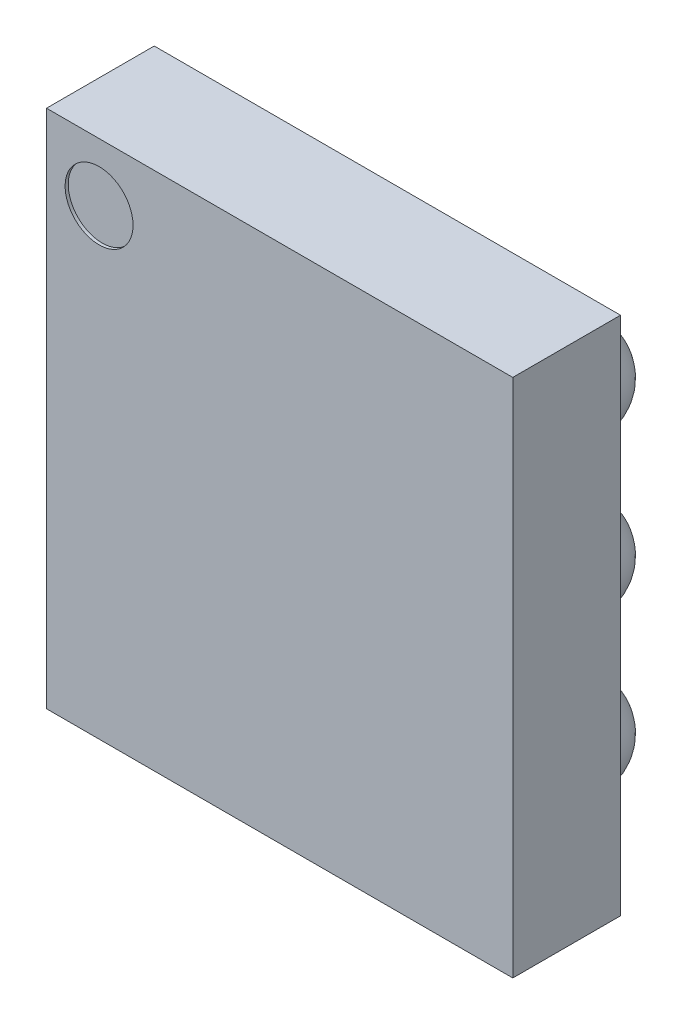
from build123d import *

# Parameters (mm, degrees)
BOSS_EXTRUDE1_START  = 0.24
SKETCH1_W            = 1.515
SKETCH1_H            = 1.69
BOSS_EXTRUDE1_DEPTH  = 0.35
SKETCH2_R            = 0.110270935
CUT_EXTRUDE1_DEPTH   = 0.01
LPATTERN1_COUNT      = 3
LPATTERN1_PITCH      = 0.5
LPATTERN1_COUNT_DIR2 = 3
LPATTERN1_PITCH_DIR2 = 0.5


with BuildPart() as part:
    # Sketch1 → Boss-Extrude1 (new body)
    with BuildSketch(Plane.XY.offset(BOSS_EXTRUDE1_START)):
        Rectangle(SKETCH1_W, SKETCH1_H)
    extrude(amount=BOSS_EXTRUDE1_DEPTH)

    # Sketch2 → Cut-Extrude1 (cut)
    with BuildSketch(Plane.XY.offset(0.59)):
        with Locations((-0.586697282, 0.656038771)):
            Circle(SKETCH2_R)
    extrude(amount=-CUT_EXTRUDE1_DEPTH, mode=Mode.SUBTRACT)

    # Sketch3 → Revolve1 (revolve)
    with BuildSketch(Plane(origin=(0.5, 0, 0), x_dir=(0, 0, -1), z_dir=(1, 0, 0))):
        with BuildLine():
            Line((-0.24, 0.5), (-0.24, 0.361435935))
            ThreePointArc((-0.24, 0.361435935), (-0.08, 0.361435935), (0, 0.5))
            Line((0, 0.5), (-0.24, 0.5))
        make_face()
    revolve1 = revolve(axis=Axis((0.5, 0.5, 0.24), (0, 0, -1)))

    # LPattern1: Revolve1 3 × 3
    with Locations(*[(-i * LPATTERN1_PITCH, -j * LPATTERN1_PITCH_DIR2, 0) for i in range(LPATTERN1_COUNT) for j in range(LPATTERN1_COUNT_DIR2) if (i, j) != (0, 0)]):
        add(revolve1)


solid = part.part
